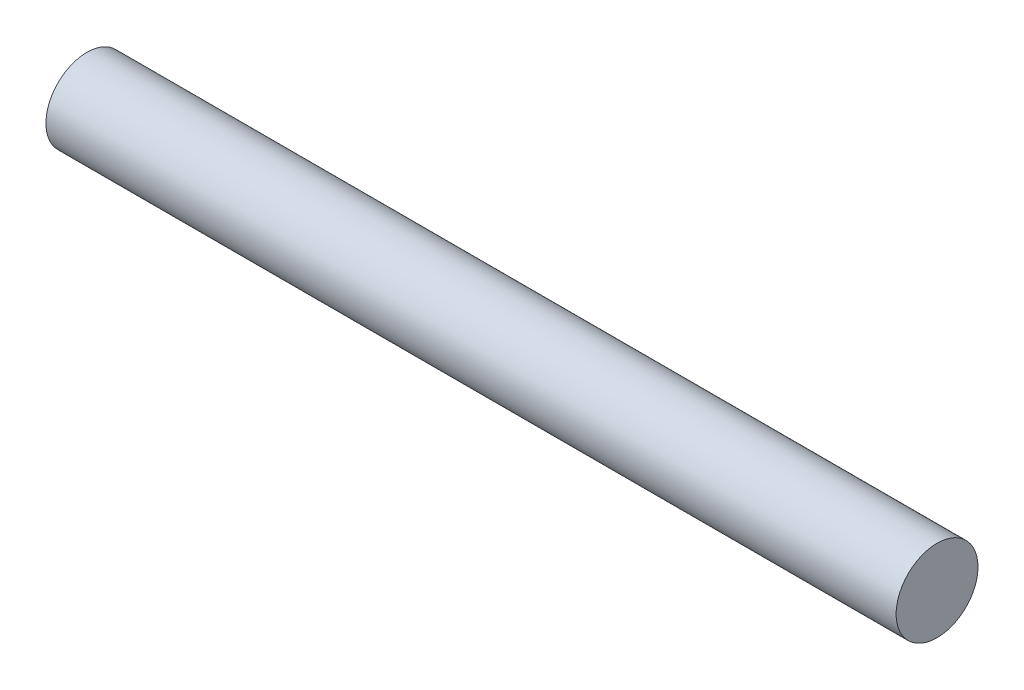
from build123d import *

# Parameters (mm, degrees)
SKETCH1_R           = 0.1651
BOSS_EXTRUDE1_DEPTH = 3.429


with BuildPart() as part:
    # Sketch1 → Boss-Extrude1 (new body)
    with BuildSketch(Plane(origin=(0, 0, 0), x_dir=(0, 0, -1), z_dir=(1, 0, 0))):
        Circle(SKETCH1_R)
    extrude(amount=BOSS_EXTRUDE1_DEPTH)


solid = part.part
